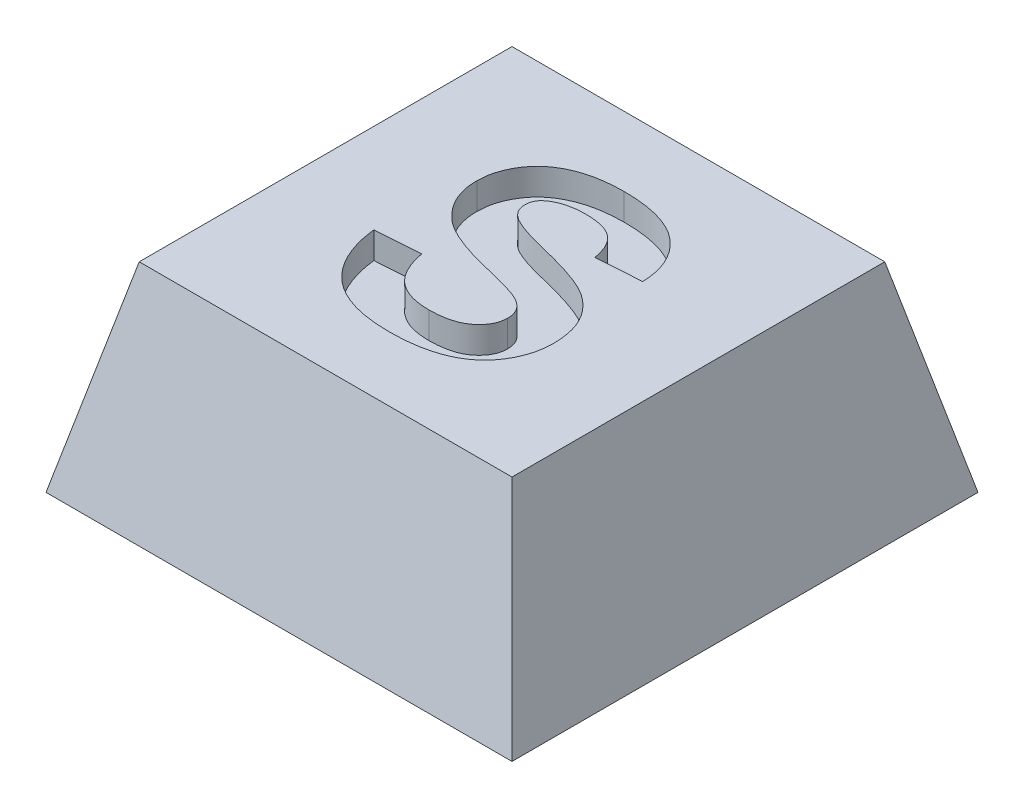
from build123d import *

# Parameters (mm, degrees)
SKETCH1_W           = 7
SKETCH1_H           = 7
BOSS_EXTRUDE1_DEPTH = 3
CUT_EXTRUDE1_DEPTH  = 7
CUT_EXTRUDE2_DEPTH  = 11
SKETCH4_R           = 1.8
CUT_EXTRUDE3_DEPTH  = 0.8
CUT_EXTRUDE4_DEPTH  = 0.4


with BuildPart() as part:
    # Sketch1 → Boss-Extrude1 (new body)
    with BuildSketch(Plane(origin=(0, 0, 0), x_dir=(1, 0, 0), z_dir=(0, 1, 0))):
        with Locations((3.5, 3.5)):
            Rectangle(SKETCH1_W, SKETCH1_H)
    extrude(amount=BOSS_EXTRUDE1_DEPTH)

    # Sketch2 → Cut-Extrude1 (cut)
    with BuildSketch(Plane.XY):
        Polygon((0, 0), (0.7, 3), (0, 3), align=None)
        Polygon((7, 0), (6.3, 3), (7, 3), align=None)
    extrude(amount=-CUT_EXTRUDE1_DEPTH, mode=Mode.SUBTRACT)

    # Sketch3 → Cut-Extrude2 (cut)
    with BuildSketch(Plane(origin=(0, 0, 0), x_dir=(0, 0, -1), z_dir=(1, 0, 0))):
        Polygon((0, 0), (0.7, 3), (0, 3), align=None)
        Polygon((7, 3), (6.3, 3), (7, 0), align=None)
    extrude(amount=CUT_EXTRUDE2_DEPTH, mode=Mode.SUBTRACT)

    # Sketch4 → Cut-Extrude3 (cut)
    with BuildSketch(Plane.XZ):
        with Locations(Location((3.5, -3.5, 0), (0, 0, 270))):
            Circle(SKETCH4_R)
    extrude(amount=-CUT_EXTRUDE3_DEPTH, mode=Mode.SUBTRACT)

    # Sketch5 → Cut-Extrude4 (cut)
    with BuildSketch(Plane(origin=(0, 3, 0), x_dir=(1, 0, 0), z_dir=(0, 1, 0))):
        with BuildLine():
            Line((2.046721013, 2.878720245), (2.719797936, 2.92359204))
            add(Edge.make_bspline(
                [(2.719797936, 2.92359204), (2.725160149, 2.895432871), (2.735575908, 2.840735478), (2.758717767, 2.762784225), (2.784190549, 2.69011155), (2.81463192, 2.623496744), (2.847957445, 2.561708471), (2.886904829, 2.506506929), (2.928757004, 2.456129675), (2.975585733, 2.412386043), (3.026605026, 2.374074766), (3.082069463, 2.341401632), (3.14137804, 2.313122445), (3.204675773, 2.289835431), (3.272615043, 2.272451562), (3.344603998, 2.260083969), (3.420745884, 2.252164104), (3.4727828, 2.251073777), (3.499445372, 2.250515117)],
                knots=[0, 0, 0, 0, 1.204560339, 2.339781841, 3.415289417, 4.440034832, 5.416475564, 6.362424008, 7.275913008, 8.16578645, 9.05021719, 9.95355393, 10.867835453, 11.809845306, 12.784702352, 13.812224031, 14.87903166, 16, 16, 16, 16], degree=3))
            add(Edge.make_bspline(
                [(3.499445372, 2.250515117), (3.527509416, 2.250821294), (3.582095427, 2.251416824), (3.661196592, 2.258804896), (3.735159775, 2.269389104), (3.803331854, 2.286143658), (3.866985877, 2.304880975), (3.924540945, 2.330515622), (3.976928433, 2.36008148), (4.024013382, 2.393631069), (4.06510446, 2.430839971), (4.101052986, 2.469684857), (4.132361778, 2.5093265), (4.157004013, 2.551524023), (4.176946643, 2.594570783), (4.190127325, 2.639750939), (4.199031656, 2.686027058), (4.200052723, 2.717653631), (4.200567167, 2.733588033)],
                knots=[0, 0, 0, 0, 1.417779877, 2.757654889, 4.012140507, 5.189587551, 6.302846416, 7.360586765, 8.365575446, 9.33904572, 10.275781718, 11.161696098, 12.012180333, 12.822428111, 13.625933072, 14.403138519, 15.195454004, 16, 16, 16, 16], degree=3))
            add(Edge.make_bspline(
                [(4.200567167, 2.733588033), (4.199936245, 2.753552546), (4.198701939, 2.792610195), (4.183842132, 2.848447381), (4.161557458, 2.900178921), (4.12800444, 2.94704074), (4.082900924, 2.989865612), (4.025366896, 3.029927231), (3.953796381, 3.065967021), (3.900700369, 3.086070082), (3.872442167, 3.096769123)],
                knots=[0, 0, 0, 0, 0.90494901, 1.770400303, 2.607161909, 3.452839393, 4.36912122, 5.420987164, 6.627424851, 8, 8, 8, 8], degree=3))
            add(Edge.make_bspline(
                [(3.872442167, 3.096769123), (3.860317321, 3.100832215), (3.833183883, 3.109924755), (3.786897121, 3.12292623), (3.731143485, 3.139161617), (3.665117302, 3.157615727), (3.588840772, 3.176489423), (3.503165804, 3.199739676), (3.407047926, 3.222875577), (3.339803742, 3.239954494), (3.304533513, 3.248912553)],
                knots=[0, 0, 0, 0, 0.521821638, 1.167752076, 1.961721917, 2.891982557, 3.96540661, 5.168436773, 6.514817513, 8, 8, 8, 8], degree=3))
            add(Edge.make_bspline(
                [(3.304533513, 3.248912553), (3.258601207, 3.260380777), (3.169982333, 3.282506842), (3.043591527, 3.321867543), (2.927183282, 3.360974579), (2.821878423, 3.403407811), (2.726515392, 3.446291426), (2.642636716, 3.492636137), (2.568492031, 3.540035098), (2.525286202, 3.57546224), (2.504553545, 3.592462232)],
                knots=[0, 0, 0, 0, 1.293880989, 2.496331788, 3.617634808, 4.64976062, 5.598842568, 6.473791081, 7.267636666, 8, 8, 8, 8], degree=3))
            add(Edge.make_bspline(
                [(2.504553545, 3.592462232), (2.478842356, 3.616535508), (2.428433193, 3.663733391), (2.362077353, 3.741288571), (2.306320379, 3.82321321), (2.260426285, 3.908902595), (2.225088701, 3.998850035), (2.200041876, 4.092453462), (2.18383066, 4.189957168), (2.182176417, 4.256359502), (2.181336398, 4.290078418)],
                knots=[0, 0, 0, 0, 1.064429417, 2.086912298, 3.078678339, 4.055528992, 5.020032834, 5.993708893, 6.981211098, 8, 8, 8, 8], degree=3))
            add(Edge.make_bspline(
                [(2.181336398, 4.290078418), (2.182972343, 4.333710293), (2.18621757, 4.420262908), (2.215978417, 4.547483438), (2.262337684, 4.670241451), (2.316103441, 4.767715859), (2.367760734, 4.841455617), (2.410658355, 4.894370593), (2.457785536, 4.943893923), (2.509787819, 4.988817578), (2.564734232, 5.031772991), (2.624753609, 5.069917913), (2.688144219, 5.105848319), (2.779877653, 5.148442144), (2.904426487, 5.192829094), (3.06647121, 5.230244475), (3.242905826, 5.252735952), (3.365228488, 5.25549518), (3.428632071, 5.256925373)],
                knots=[0, 0, 0, 0, 1.180131776, 2.341029169, 3.518901375, 4.725685298, 5.343762192, 5.955650671, 6.568945152, 7.192346361, 7.815201106, 8.455999361, 9.116257477, 9.787318263, 11.192748436, 12.688084276, 14.283332633, 16, 16, 16, 16], degree=3))
            add(Edge.make_bspline(
                [(3.428632071, 5.256925373), (3.480546978, 5.25623114), (3.581520363, 5.254880873), (3.727893013, 5.241226755), (3.86461301, 5.219975735), (3.991200587, 5.189469994), (4.107714725, 5.149163904), (4.214607068, 5.10115173), (4.311786782, 5.044149232), (4.3980708, 4.977829293), (4.474941591, 4.904715813), (4.541999061, 4.824854673), (4.599499587, 4.739254471), (4.647814268, 4.647977762), (4.68575566, 4.550555251), (4.713622114, 4.447108501), (4.732053229, 4.337881002), (4.736673044, 4.263037228), (4.739028705, 4.224874091)],
                knots=[0, 0, 0, 0, 1.325124071, 2.577337985, 3.749592149, 4.855247722, 5.896868755, 6.892903601, 7.842551483, 8.766257401, 9.665194363, 10.546067736, 11.423174165, 12.293291263, 13.177512979, 14.086532529, 15.024315359, 16, 16, 16, 16], degree=3))
            Line((4.739028705, 4.224874091), (4.065951782, 4.180002296))
            add(Edge.make_bspline(
                [(4.065951782, 4.180002296), (4.062068972, 4.201108183), (4.054501777, 4.242241362), (4.038048624, 4.301152432), (4.019490266, 4.355638451), (3.997768669, 4.405699072), (3.971531605, 4.45043766), (3.942978139, 4.491261716), (3.911320612, 4.527627281), (3.875510829, 4.55853855), (3.83677937, 4.586666537), (3.792639157, 4.60921177), (3.744939713, 4.630128784), (3.691866364, 4.645853249), (3.634438311, 4.65832646), (3.572622102, 4.667573288), (3.506289601, 4.672088109), (3.460655286, 4.673079253), (3.437045532, 4.67359204)],
                knots=[0, 0, 0, 0, 1.151066407, 2.24330871, 3.278475654, 4.238599069, 5.165719782, 6.056502506, 6.909492653, 7.744782051, 8.590364415, 9.471203867, 10.39832458, 11.382154319, 12.435022857, 13.550631277, 14.73277401, 16, 16, 16, 16], degree=3))
            add(Edge.make_bspline(
                [(3.437045532, 4.67359204), (3.412497837, 4.673139334), (3.364739198, 4.672258574), (3.295142133, 4.666853479), (3.229854863, 4.656876194), (3.168556746, 4.643888244), (3.11132966, 4.626219037), (3.058294374, 4.604674333), (3.009208245, 4.579309585), (2.979277664, 4.559353476), (2.964489443, 4.549493482)],
                knots=[0, 0, 0, 0, 1.186678824, 2.308736671, 3.37120409, 4.377216403, 5.334874112, 6.262130804, 7.141346615, 8, 8, 8, 8], degree=3))
            add(Edge.make_bspline(
                [(2.964489443, 4.549493482), (2.947565565, 4.53602445), (2.914789266, 4.509939115), (2.879515034, 4.458142509), (2.858279864, 4.399639797), (2.855723971, 4.358268553), (2.854413321, 4.337053578)],
                knots=[0, 0, 0, 0, 1.037857257, 2.010007357, 2.979541333, 4, 4, 4, 4], degree=3))
            add(Edge.make_bspline(
                [(2.854413321, 4.337053578), (2.855485194, 4.317226776), (2.857596612, 4.27817113), (2.878892988, 4.22269174), (2.911643913, 4.171286094), (2.942244281, 4.143361874), (2.958179346, 4.128820405)],
                knots=[0, 0, 0, 0, 0.98538058, 1.941042925, 2.927803204, 4, 4, 4, 4], degree=3))
            add(Edge.make_bspline(
                [(2.958179346, 4.128820405), (2.970825874, 4.119382262), (2.9990856, 4.098291942), (3.050851816, 4.07148415), (3.113334997, 4.042449691), (3.187959609, 4.014065302), (3.274229699, 3.985733602), (3.372150512, 3.956152032), (3.481782274, 3.926173301), (3.600330525, 3.897140369), (3.720690389, 3.868602665), (3.835546491, 3.837402899), (3.942346149, 3.806985541), (4.040594163, 3.775103213), (4.130796984, 3.744065866), (4.212516439, 3.712188275), (4.286313644, 3.681143069), (4.372369366, 3.63845371), (4.469904872, 3.580629249), (4.572133086, 3.496571752), (4.662540895, 3.402085635), (4.725534654, 3.312991744), (4.76880807, 3.236368627), (4.796671585, 3.175291081), (4.82077571, 3.110930748), (4.840396402, 3.043216506), (4.854616683, 2.972053072), (4.866384793, 2.897984135), (4.872397339, 2.820394537), (4.873224033, 2.767483952), (4.87364409, 2.740599251)],
                knots=[0, 0, 0, 0, 0.511875881, 1.143829537, 1.88775736, 2.750598373, 3.734912702, 4.837306479, 6.073130119, 7.42648979, 8.801963576, 10.091065733, 11.292408984, 12.408830014, 13.446061236, 14.39066453, 15.257936293, 16.045629259, 17.510392066, 18.929669597, 20.331293837, 21.746891395, 22.460690638, 23.187651344, 23.925159671, 24.69163991, 25.474819891, 26.281170188, 27.126635539, 28, 28, 28, 28], degree=3))
            add(Edge.make_bspline(
                [(4.87364409, 2.740599251), (4.873066499, 2.715805547), (4.871919459, 2.666567652), (4.86390363, 2.593486185), (4.851507352, 2.52170251), (4.833156603, 2.451126638), (4.80881246, 2.381897405), (4.78140289, 2.313015643), (4.747128767, 2.245983517), (4.708120139, 2.18074551), (4.665091851, 2.117350577), (4.616332808, 2.058870196), (4.564706926, 2.003353319), (4.506915449, 1.953908582), (4.44652713, 1.906532418), (4.38077987, 1.864575291), (4.311214031, 1.826607806), (4.237389761, 1.792913428), (4.159045311, 1.763551823), (4.076282436, 1.737417953), (3.988355491, 1.716029388), (3.895997661, 1.697696694), (3.798870959, 1.683755153), (3.697096814, 1.674020716), (3.590652088, 1.66853108), (3.51814807, 1.667637137), (3.481216205, 1.667181783)],
                knots=[0, 0, 0, 0, 0.900570041, 1.788444861, 2.667795364, 3.545012114, 4.433698372, 5.332345486, 6.235991676, 7.164928091, 8.092777575, 9.015680987, 9.928493428, 10.842962589, 11.775229507, 12.714851019, 13.672254427, 14.652424454, 15.660007982, 16.709910502, 17.803296389, 18.945495772, 20.129342395, 21.366102753, 22.658353839, 24, 24, 24, 24], degree=3))
            add(Edge.make_bspline(
                [(3.481216205, 1.667181783), (3.427892291, 1.668052387), (3.324069365, 1.669747473), (3.173233299, 1.684919824), (3.031759055, 1.708142203), (2.899876942, 1.741845708), (2.777425768, 1.785113401), (2.664461381, 1.838409645), (2.561530178, 1.902052856), (2.4673573, 1.97449958), (2.383197452, 2.057069979), (2.307520748, 2.148053225), (2.241348087, 2.248268606), (2.184722964, 2.357559374), (2.136213798, 2.475334702), (2.096207822, 2.601648673), (2.066085424, 2.737103735), (2.053287453, 2.830698323), (2.046721013, 2.878720245)],
                knots=[0, 0, 0, 0, 1.217954099, 2.371385517, 3.459848295, 4.490682126, 5.476952527, 6.422732854, 7.338496285, 8.236688651, 9.131557988, 10.026443255, 10.935708282, 11.869506048, 12.834296687, 13.842423496, 14.892981177, 16, 16, 16, 16], degree=3))
        make_face()
    extrude(amount=-CUT_EXTRUDE4_DEPTH, mode=Mode.SUBTRACT)


solid = part.part
